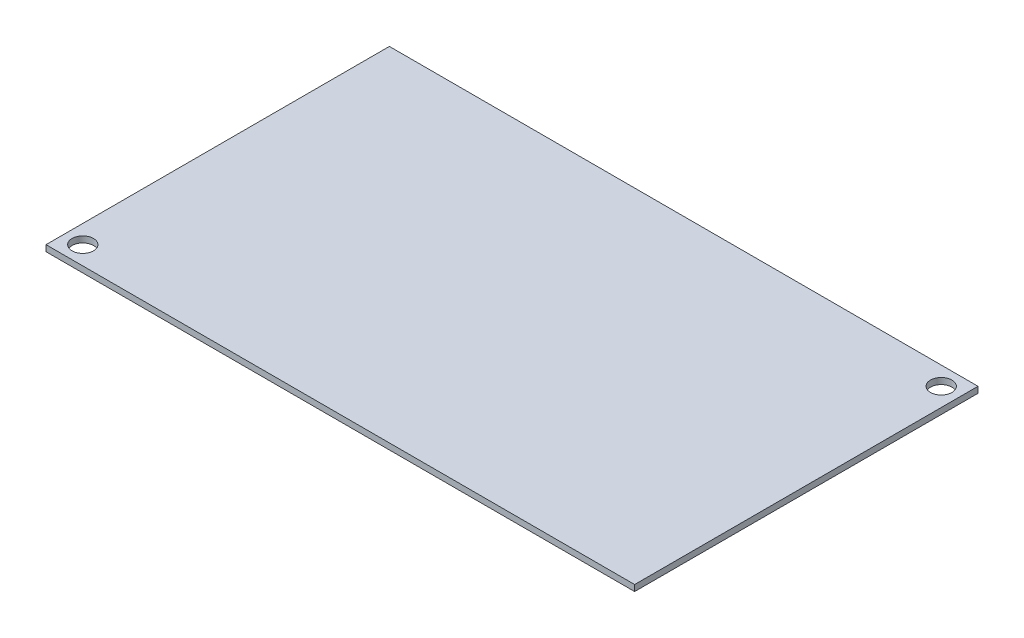
from build123d import *

# Parameters (mm, degrees)
SKETCH1_W      = 121.92
SKETCH1_H      = 71.12
SKETCH1_R      = 2.2225
EXTRUDE1_DEPTH = 1.27


with BuildPart() as part:
    # Sketch1 → Extrude1 (new body)
    with BuildSketch(Plane(origin=(0, 0, 0), x_dir=(1, 0, 0), z_dir=(0, 1, 0))):
        with Locations((60.96, 35.56)):
            Rectangle(SKETCH1_W, SKETCH1_H)
        with Locations(Location((3.81, 3.81, 0), (0, 0, 270))):
            Circle(SKETCH1_R, mode=Mode.SUBTRACT)
        with Locations(Location((118.11, 67.31, 0), (0, 0, 270))):
            Circle(SKETCH1_R, mode=Mode.SUBTRACT)
    extrude(amount=EXTRUDE1_DEPTH)


solid = part.part
